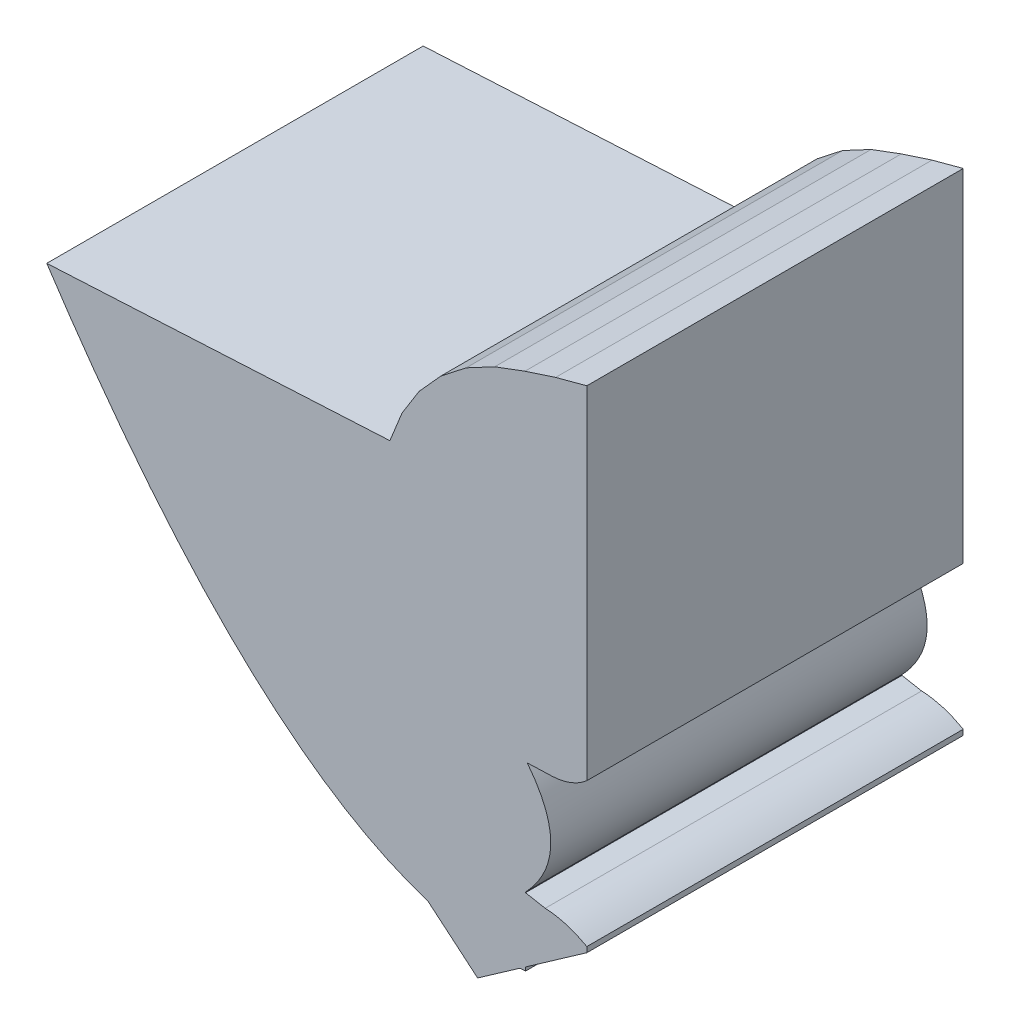
from build123d import *

# Parameters (mm, degrees)
CROQUIS_BASE_DEPTH              = 6.9937
LENTE_PPAL_1_REACH              = 29.176
LENTE_PPAL_1_DIRECTION_2_REACH  = 29.176
LENTE_PPAL_2_DEPTH              = 28.175928622
LENTE_PPAL_2_DEPTH_BACK         = 28.175928622
CROQUIS9_3_OUTSIDE_W            = 30.065
CROQUIS9_3_OUTSIDE_H            = 25.937
LENTE_FRONTAL_REACH             = 25.403
LENTE_FRONTAL_DIRECTION_2_REACH = 25.403
LENTE_TRASERA_REACH             = 28.281
LENTE_TRASERA_DIRECTION_2_REACH = 28.281


with BuildPart() as part:
    # Croquis1 → croquis base (new, symmetric)
    with BuildSketch(Plane.XY):
        with BuildLine():
            Line((-8.981845695, 12.608155172), (-23.035921146, 11.871612288))
            Line((-23.035921146, 11.871612288), (-23.035921146, 11.54013782))
            ThreePointArc((-23.035921146, 11.54013782), (-20.949684518, 9.582335705), (-18.945192114, 7.540918896))
            add(Edge.make_bspline(
                [(-18.945192114, 7.540918896), (-10.215008384, -3.697644103), (-2.846604825, -5.059081104)],
                knots=[0.497667241, 0.497667241, 0.497667241, 0.49955428, 0.49955428, 0.49955428], degree=2, weights=[1, 1, 1]))
            add(Edge.make_bspline(
                [(-2.846604825, -5.059081104), (-2.498165198, -4.87297933), (-2.177330418, -4.684462446)],
                knots=[0.498812075, 0.498812075, 0.498812075, 0.498911556, 0.498911556, 0.498911556], degree=2, weights=[1, 1, 1]))
            Line((-2.177330418, -4.684462446), (-2.177330418, 6.186438919))
            add(Edge.make_bspline(
                [(-2.177330418, 6.186438919), (-4.063319702, 8.141636997), (-6.994875026, 10.477389992)],
                knots=[0.50138293, 0.50138293, 0.50138293, 0.502013312, 0.502013312, 0.502013312], degree=2, weights=[1, 1, 1]))
            Line((-6.994875026, 10.477389992), (-8.981845695, 12.608155172))
        make_face()
    extrude(amount=CROQUIS_BASE_DEPTH, both=True)

    # lente ppal 1: up to this face of the body (flat: up to its plane)
    lente_ppal_1_end = Plane(part.part.faces().sort_by_distance((-10.153546236, 5.159655325, 6.9937))[0])
    # Croquis9 → lente ppal 1 (add, up to the picked face)
    with BuildSketch(Plane.XY, mode=Mode.PRIVATE) as lente_ppal_1_sk1:
        with BuildLine():
            add(Edge.make_bspline(
                [(-2.177330418, -4.388282022), (-10.4130765, -4.994158739), (-19.969359014, 9.493765032)],
                knots=[0, 0, 0, 1, 1, 1], degree=2))
            Line((-19.969359014, 9.493765032), (-10.309820395, 10))
            Line((-10.309820395, 10), (-2.177330418, 6.082860828))
            Line((-2.177330418, 6.082860828), (-2.177330418, 2.424232079))
            add(Edge.make_bspline(
                [(-2.177330418, 2.424232079), (-0.304369248, 0.128042884), (-2.177330418, -1.840420572)],
                knots=[0, 0, 0, 1, 1, 1], degree=2))
            Line((-2.177330418, -1.840420572), (-2.177330418, -4.388282022))
        make_face()
    lente_ppal_1_tool1 = split(extrude(lente_ppal_1_sk1.sketch, amount=LENTE_PPAL_1_REACH, mode=Mode.PRIVATE), bisect_by=lente_ppal_1_end, keep=Keep.BOTH, mode=Mode.PRIVATE)
    add(lente_ppal_1_tool1.solids().sort_by(Axis((-9.106368, 3.599172, 0), (0, 0, 1)))[0])

    # lente ppal 1 direction 2: up to this face of the body (flat: up to its plane)
    lente_ppal_1_direction_2_end = Plane(part.part.faces().sort_by_distance((-10.153546236, 5.159655325, -6.9937))[0])
    # Croquis9 → lente ppal 1 direction 2 (add, up to the picked face)
    with BuildSketch(Plane.XY, mode=Mode.PRIVATE) as lente_ppal_1_direction_2_sk1:
        with BuildLine():
            add(Edge.make_bspline(
                [(-2.177330418, -4.388282022), (-10.4130765, -4.994158739), (-19.969359014, 9.493765032)],
                knots=[0, 0, 0, 1, 1, 1], degree=2))
            Line((-19.969359014, 9.493765032), (-10.309820395, 10))
            Line((-10.309820395, 10), (-2.177330418, 6.082860828))
            Line((-2.177330418, 6.082860828), (-2.177330418, 2.424232079))
            add(Edge.make_bspline(
                [(-2.177330418, 2.424232079), (-0.304369248, 0.128042884), (-2.177330418, -1.840420572)],
                knots=[0, 0, 0, 1, 1, 1], degree=2))
            Line((-2.177330418, -1.840420572), (-2.177330418, -4.388282022))
        make_face()
    lente_ppal_1_direction_2_tool1 = split(extrude(lente_ppal_1_direction_2_sk1.sketch, amount=-LENTE_PPAL_1_DIRECTION_2_REACH, mode=Mode.PRIVATE), bisect_by=lente_ppal_1_direction_2_end, keep=Keep.BOTH, mode=Mode.PRIVATE)
    add(lente_ppal_1_direction_2_tool1.solids().sort_by(Axis((-9.106368, 3.599172, 0), (0, 0, -1)))[0])

    # Croquis9<3> outside → lente ppal 2 (cut, two sides: drawn at the far end of the back side and taken through both)
    with BuildSketch(Plane.XY.offset(-LENTE_PPAL_2_DEPTH_BACK)):
        with Locations((-12.1385, 3.7745)):
            Rectangle(CROQUIS9_3_OUTSIDE_W, CROQUIS9_3_OUTSIDE_H)
        with BuildLine():
            Line((-2.177330418, -1.840420572), (-2.177330418, -4.388282022))
            add(Edge.make_bspline(
                [(-2.177330418, -4.388282022), (-10.4130765, -4.994158739), (-19.969359014, 9.493765032)],
                knots=[0, 0, 0, 1, 1, 1], degree=2))
            Line((-19.969359014, 9.493765032), (-10.309820395, 10))
            Line((-10.309820395, 10), (-2.177330418, 6.082860828))
            Line((-2.177330418, 6.082860828), (-2.177330418, 2.424232079))
            add(Edge.make_bspline(
                [(-2.177330418, 2.424232079), (-0.304369248, 0.128042884), (-2.177330418, -1.840420572)],
                knots=[0, 0, 0, 1, 1, 1], degree=2))
        make_face(mode=Mode.SUBTRACT)
    extrude(amount=LENTE_PPAL_2_DEPTH + LENTE_PPAL_2_DEPTH_BACK, mode=Mode.SUBTRACT)

    # lente frontal: up to this face of the body (flat: up to its plane)
    lente_frontal_end = Plane(part.part.faces().sort_by_distance((-9.106367081, 3.599171888, 6.9937))[0])
    # Croquis8 → lente frontal (add, up to the picked face)
    with BuildSketch(Plane.XY, mode=Mode.PRIVATE) as lente_frontal_sk1:
        with BuildLine():
            Line((0.1, 2.877673418), (0.1, 15.587903347))
            Line((0.1, 15.587903347), (-1.059110992, 15.277320493))
            Line((-1.059110992, 15.277320493), (-2.200378811, 14.9065001))
            Line((-2.200378811, 14.9065001), (-3.324385438, 14.486251242))
            Line((-3.324385438, 14.486251242), (-4.38392255, 13.922885367))
            Line((-4.38392255, 13.922885367), (-5.329535454, 13.184091597))
            Line((-5.329535454, 13.184091597), (-6.132492182, 12.292317806))
            Line((-6.132492182, 12.292317806), (-6.768395299, 11.274660091))
            Line((-6.768395299, 11.274660091), (-7.217923211, 10.162039465))
            Line((-7.217923211, 10.162039465), (-10.309820395, 10))
            Line((-10.309820395, 10), (-2.177330418, 2.342487007))
            Line((-2.177330418, 2.342487007), (-1.190501641, 2.376947827))
            add(Edge.make_bspline(
                [(-1.190501641, 2.376947827), (-0.463368169, 2.402339888), (0.1, 2.877673418)],
                knots=[0, 0, 0, 1, 1, 1], degree=2))
        make_face()
    lente_frontal_tool1 = split(extrude(lente_frontal_sk1.sketch, amount=LENTE_FRONTAL_REACH, mode=Mode.PRIVATE), bisect_by=lente_frontal_end, keep=Keep.BOTH, mode=Mode.PRIVATE)
    add(lente_frontal_tool1.solids().sort_by(Axis((-3.290182, 8.96302, 0), (0, 0, 1)))[0])

    # lente frontal direction 2: up to this face of the body (flat: up to its plane)
    lente_frontal_direction_2_end = Plane(part.part.faces().sort_by_distance((-9.106367081, 3.599171888, -6.9937))[0])
    # Croquis8 → lente frontal direction 2 (add, up to the picked face)
    with BuildSketch(Plane.XY, mode=Mode.PRIVATE) as lente_frontal_direction_2_sk1:
        with BuildLine():
            Line((0.1, 2.877673418), (0.1, 15.587903347))
            Line((0.1, 15.587903347), (-1.059110992, 15.277320493))
            Line((-1.059110992, 15.277320493), (-2.200378811, 14.9065001))
            Line((-2.200378811, 14.9065001), (-3.324385438, 14.486251242))
            Line((-3.324385438, 14.486251242), (-4.38392255, 13.922885367))
            Line((-4.38392255, 13.922885367), (-5.329535454, 13.184091597))
            Line((-5.329535454, 13.184091597), (-6.132492182, 12.292317806))
            Line((-6.132492182, 12.292317806), (-6.768395299, 11.274660091))
            Line((-6.768395299, 11.274660091), (-7.217923211, 10.162039465))
            Line((-7.217923211, 10.162039465), (-10.309820395, 10))
            Line((-10.309820395, 10), (-2.177330418, 2.342487007))
            Line((-2.177330418, 2.342487007), (-1.190501641, 2.376947827))
            add(Edge.make_bspline(
                [(-1.190501641, 2.376947827), (-0.463368169, 2.402339888), (0.1, 2.877673418)],
                knots=[0, 0, 0, 1, 1, 1], degree=2))
        make_face()
    lente_frontal_direction_2_tool1 = split(extrude(lente_frontal_direction_2_sk1.sketch, amount=-LENTE_FRONTAL_DIRECTION_2_REACH, mode=Mode.PRIVATE), bisect_by=lente_frontal_direction_2_end, keep=Keep.BOTH, mode=Mode.PRIVATE)
    add(lente_frontal_direction_2_tool1.solids().sort_by(Axis((-3.290182, 8.96302, 0), (0, 0, -1)))[0])

    # lente trasera: up to this face of the body (flat: up to its plane)
    lente_trasera_end = Plane(part.part.faces().sort_by_distance((-7.357064552, 5.305385386, 6.9937))[0])
    # Croquis11 → lente trasera (add, up to the picked face)
    with BuildSketch(Plane.XY, mode=Mode.PRIVATE) as lente_trasera_sk1:
        with BuildLine():
            Line((0.1, -2.458811066), (0.1, -2.658811066))
            Line((0.1, -2.658811066), (-3.957638313, -5.5))
            Line((-3.957638313, -5.5), (-10.029650265, -0.404977011))
            Line((-10.029650265, -0.404977011), (-1.447650757, -2.001370848))
            add(Edge.make_bspline(
                [(-1.447650757, -2.001370848), (-0.67030688, -2.028516294), (0.1, -2.458811066)],
                knots=[0, 0, 0, 1, 1, 1], degree=2))
        make_face()
    lente_trasera_tool1 = split(extrude(lente_trasera_sk1.sketch, amount=LENTE_TRASERA_REACH, mode=Mode.PRIVATE), bisect_by=lente_trasera_end, keep=Keep.BOTH, mode=Mode.PRIVATE)
    add(lente_trasera_tool1.solids().sort_by(Axis((-4.514125, -2.758798, 0), (0, 0, 1)))[0])

    # lente trasera direction 2: up to this face of the body (flat: up to its plane)
    lente_trasera_direction_2_end = Plane(part.part.faces().sort_by_distance((-7.357064552, 5.305385386, -6.9937))[0])
    # Croquis11 → lente trasera direction 2 (add, up to the picked face)
    with BuildSketch(Plane.XY, mode=Mode.PRIVATE) as lente_trasera_direction_2_sk1:
        with BuildLine():
            Line((0.1, -2.458811066), (0.1, -2.658811066))
            Line((0.1, -2.658811066), (-3.957638313, -5.5))
            Line((-3.957638313, -5.5), (-10.029650265, -0.404977011))
            Line((-10.029650265, -0.404977011), (-1.447650757, -2.001370848))
            add(Edge.make_bspline(
                [(-1.447650757, -2.001370848), (-0.67030688, -2.028516294), (0.1, -2.458811066)],
                knots=[0, 0, 0, 1, 1, 1], degree=2))
        make_face()
    lente_trasera_direction_2_tool1 = split(extrude(lente_trasera_direction_2_sk1.sketch, amount=-LENTE_TRASERA_DIRECTION_2_REACH, mode=Mode.PRIVATE), bisect_by=lente_trasera_direction_2_end, keep=Keep.BOTH, mode=Mode.PRIVATE)
    add(lente_trasera_direction_2_tool1.solids().sort_by(Axis((-4.514125, -2.758798, 0), (0, 0, -1)))[0])


solid = part.part
